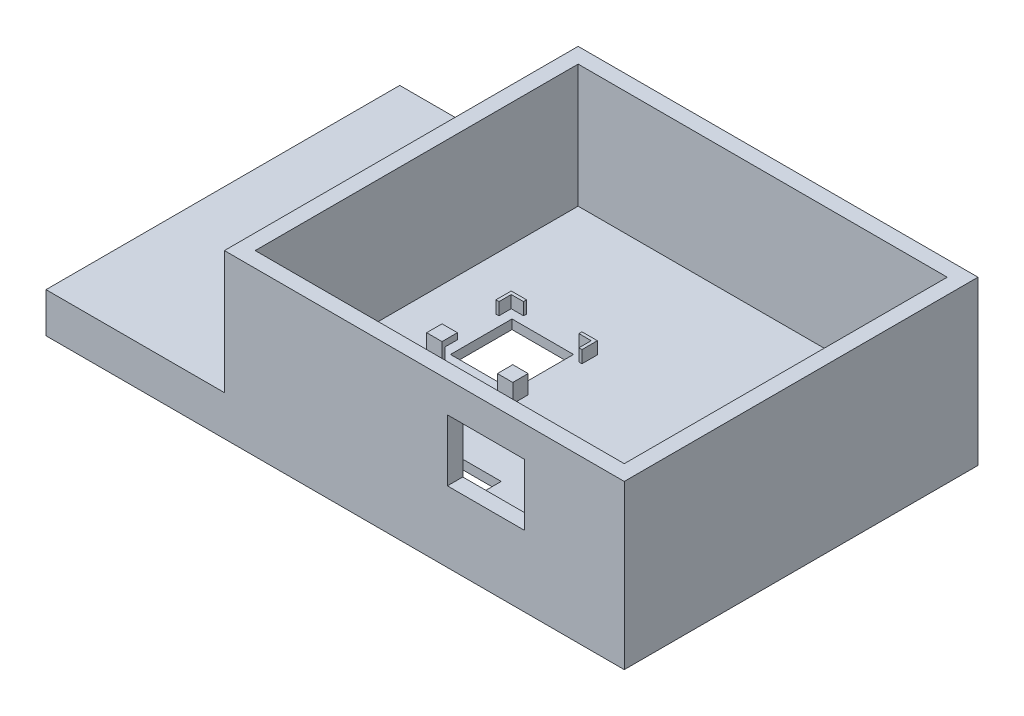
from build123d import *

# Parameters (mm, degrees)
SKETCH1_W           = 188
SKETCH1_H           = 115
SKETCH1_W_2         = 178
SKETCH1_H_2         = 105
BOSS_EXTRUDE1_DEPTH = 10
SKETCH2_W           = 188
SKETCH2_H           = 115
BOSS_EXTRUDE2_DEPTH = 3
BOSS_EXTRUDE3_DEPTH = 4
CUT_EXTRUDE1_REACH  = 222.767
SKETCH3_3_W         = 20
SKETCH3_3_H         = 20
SKETCH4_W           = 130
SKETCH4_H           = 115
SKETCH4_W_2         = 120
SKETCH4_H_2         = 105
BOSS_EXTRUDE4_DEPTH = 40
SKETCH9_W           = 5
SKETCH9_H           = 5
BOSS_EXTRUDE5_DEPTH = 2
CUT_EXTRUDE2_REACH  = 225.984
SKETCH10_W          = 20
SKETCH10_H          = 15
CUT_EXTRUDE3_REACH  = 226.172
SKETCH11_W          = 25
SKETCH11_H          = 20


with BuildPart() as part:
    # Sketch1 → Boss-Extrude1 (new body)
    with BuildSketch(Plane(origin=(0, 0, 0), x_dir=(1, 0, 0), z_dir=(0, 1, 0))):
        with Locations((94, 57.5)):
            Rectangle(SKETCH1_W, SKETCH1_H)
        with Locations((94, 57.5)):
            Rectangle(SKETCH1_W_2, SKETCH1_H_2, mode=Mode.SUBTRACT)
    extrude(amount=BOSS_EXTRUDE1_DEPTH)

    # Sketch2 → Boss-Extrude2 (add)
    with BuildSketch(Plane(origin=(0, 10, 0), x_dir=(1, 0, 0), z_dir=(0, 1, 0))):
        with Locations((94, 57.5)):
            Rectangle(SKETCH2_W, SKETCH2_H)
    extrude(amount=BOSS_EXTRUDE2_DEPTH)

    # Sketch3 → Boss-Extrude3 (add)
    with BuildSketch(Plane(origin=(0, 13, 0), x_dir=(1, 0, 0), z_dir=(0, 1, 0))):
        Polygon((80, 71.25), (80, 66.25), (81, 66.25), (81, 70.25), (85, 70.25), (85, 71.25), align=None)
        Polygon((85, 44.75), (81, 44.75), (81, 48.75), (80, 48.75), (80, 43.75), (85, 43.75), align=None)
        Polygon((107, 48.75), (107, 44.75), (103, 44.75), (103, 43.75), (108, 43.75), (108, 48.75), align=None)
        Polygon((108, 71.25), (103, 71.25), (103, 70.25), (107, 70.25), (107, 66.25), (108, 66.25), align=None)
    extrude(amount=BOSS_EXTRUDE3_DEPTH)

    # Sketch3<3> → Cut-Extrude1 (cut, up to next)
    with BuildSketch(Plane(origin=(0, 13, 0), x_dir=(1, 0, 0), z_dir=(0, 1, 0)), mode=Mode.PRIVATE) as cut_extrude1_sk1:
        with Locations((94, 57.5)):
            Rectangle(SKETCH3_3_W, SKETCH3_3_H)
    cut_extrude1_tool1 = extrude(cut_extrude1_sk1.sketch, amount=-CUT_EXTRUDE1_REACH, mode=Mode.PRIVATE) & part.part
    add(cut_extrude1_tool1.solids().sort_by_distance((94, 13, -57.5))[0], mode=Mode.SUBTRACT)

    # Sketch4 → Boss-Extrude4 (add)
    with BuildSketch(Plane(origin=(0, 13, 0), x_dir=(1, 0, 0), z_dir=(0, 1, 0))):
        with Locations((123, 57.5)):
            Rectangle(SKETCH4_W, SKETCH4_H)
        with Locations((123, 57.5)):
            Rectangle(SKETCH4_W_2, SKETCH4_H_2, mode=Mode.SUBTRACT)
    extrude(amount=BOSS_EXTRUDE4_DEPTH)

    # Sketch9 → Boss-Extrude5 (add)
    with BuildSketch(Plane(origin=(0, 17, 0), x_dir=(1, 0, 0), z_dir=(0, 1, 0))):
        with Locations((82.5, 46.25)):
            Rectangle(SKETCH9_W, SKETCH9_H)
        with Locations((105.5, 46.25)):
            Rectangle(SKETCH9_W, SKETCH9_H)
    extrude(amount=BOSS_EXTRUDE5_DEPTH)

    # Sketch10 → Cut-Extrude2 (cut, up to next)
    with BuildSketch(Plane(origin=(0, 13, 0), x_dir=(1, 0, 0), z_dir=(0, 1, 0)), mode=Mode.PRIVATE) as cut_extrude2_sk1:
        with Locations((118, 12.5)):
            Rectangle(SKETCH10_W, SKETCH10_H)
    cut_extrude2_tool1 = extrude(cut_extrude2_sk1.sketch, amount=-CUT_EXTRUDE2_REACH, mode=Mode.PRIVATE) & part.part
    add(cut_extrude2_tool1.solids().sort_by_distance((118, 13, -12.5))[0], mode=Mode.SUBTRACT)

    # Sketch11 → Cut-Extrude3 (cut, up to next)
    with BuildSketch(Plane(origin=(0, 0, -5), x_dir=(-1, 0, 0), z_dir=(0, 0, -1)), mode=Mode.PRIVATE) as cut_extrude3_sk1:
        with Locations((-143, 33)):
            Rectangle(SKETCH11_W, SKETCH11_H)
    cut_extrude3_tool1 = extrude(cut_extrude3_sk1.sketch, amount=-CUT_EXTRUDE3_REACH, mode=Mode.PRIVATE) & part.part
    add(cut_extrude3_tool1.solids().sort_by_distance((143, 33, -5))[0], mode=Mode.SUBTRACT)


solid = part.part
